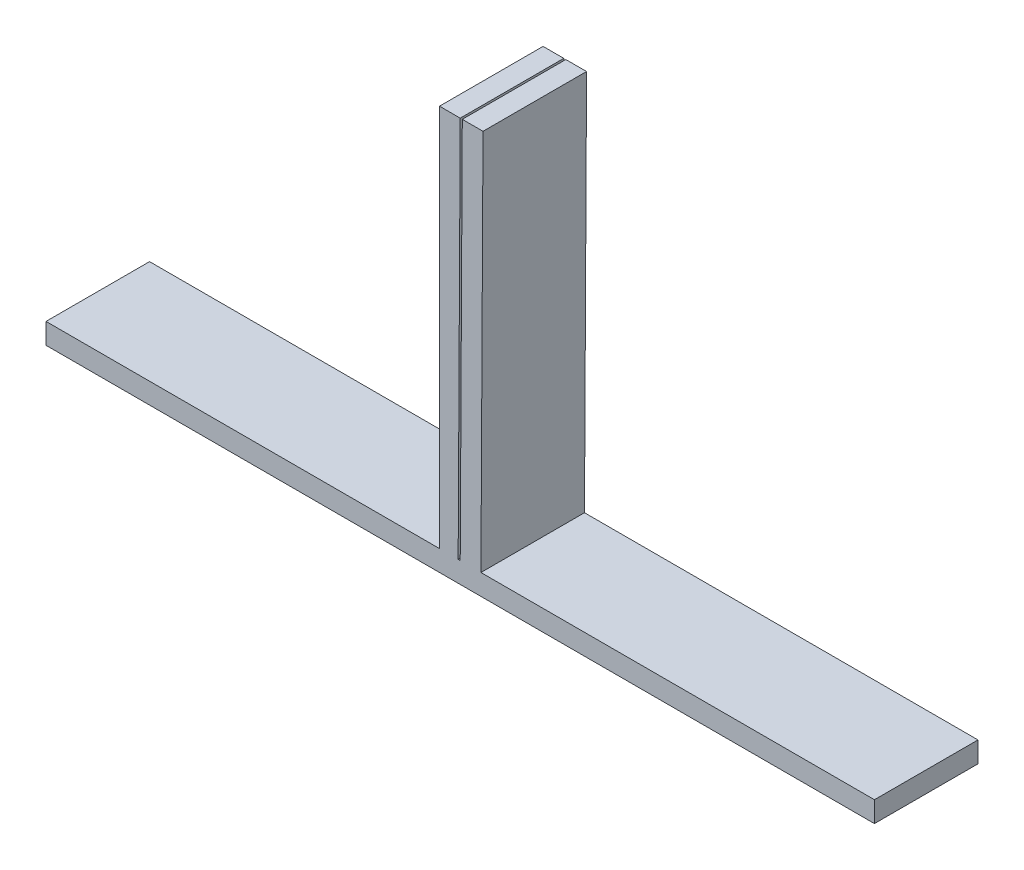
from build123d import *

# Parameters (mm, degrees)
BOSS_EXTRU_1_DEPTH = 10


with BuildPart() as part:
    # Esquisse1 → Boss.-Extru.1 (new body)
    with BuildSketch(Plane.XY):
        Polygon((37.196716412, 0), (-42.803283588, 0), (-42.803283588, 2), (-4.803283588, 2), (-4.803283588, 39), (-2.803283588, 39), (-3.003284075, 2.000540547), (-2.803284075, 2.000540547), (-2.603283588, 39), (-0.603283661, 38.999459456), (-0.803283588, 2), (37.196716412, 2), align=None)
    extrude(amount=BOSS_EXTRU_1_DEPTH)


solid = part.part
